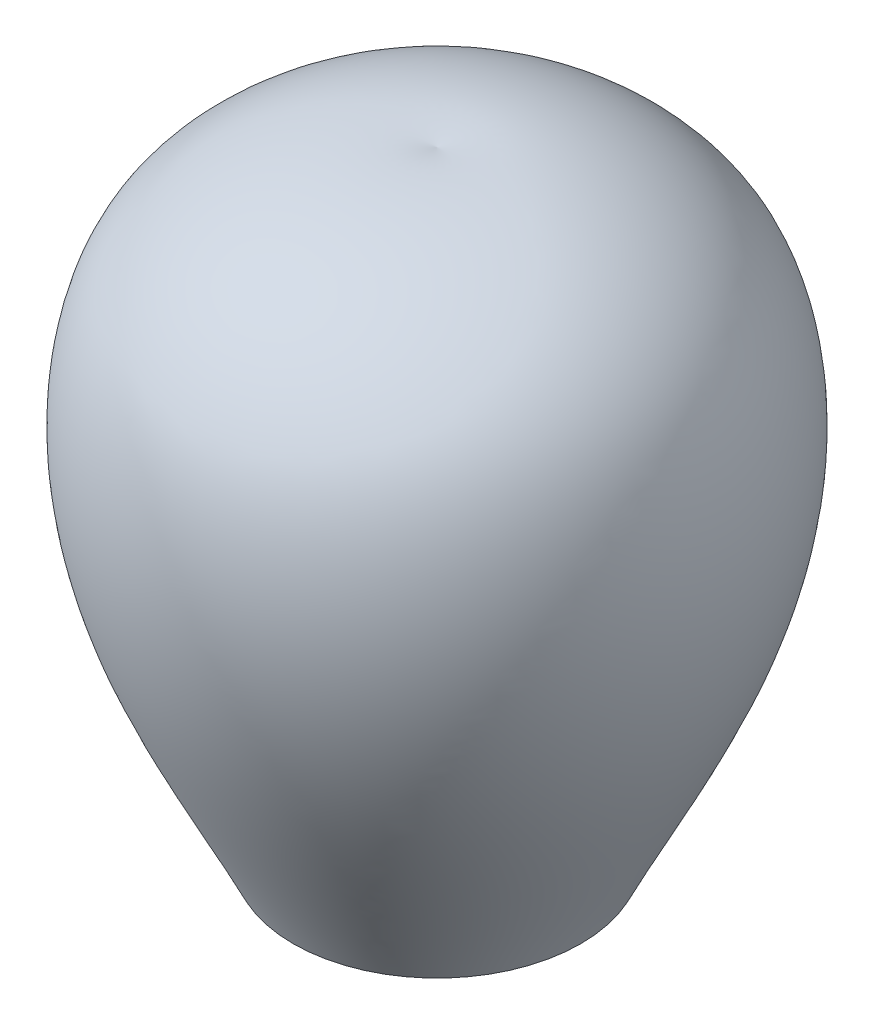
from build123d import *


with BuildPart() as part:
    # Sketch1 → Revolve1 (revolve)
    with BuildSketch(Plane.XY):
        with BuildLine():
            Line((0, -7.767406274), (0, 13.716908952))
            add(Edge.make_bspline(
                [(0, 13.716908952), (-3.030002417, 14.239345436), (-8.081670031, 12.350567892), (-9.995019894, 5.792415994), (-8.925582569, -0.663122306), (-6.242871596, -5.193339973), (-5, -7.767406274)],
                knots=[0, 0, 0, 0, 0.337005827, 0.447194855, 0.698598688, 1, 1, 1, 1], degree=3))
            Line((-5, -7.767406274), (0, -7.767406274))
        make_face()
    revolve(axis=Axis((0, 16.361132364, 0), (0, -1, 0)))


solid = part.part
